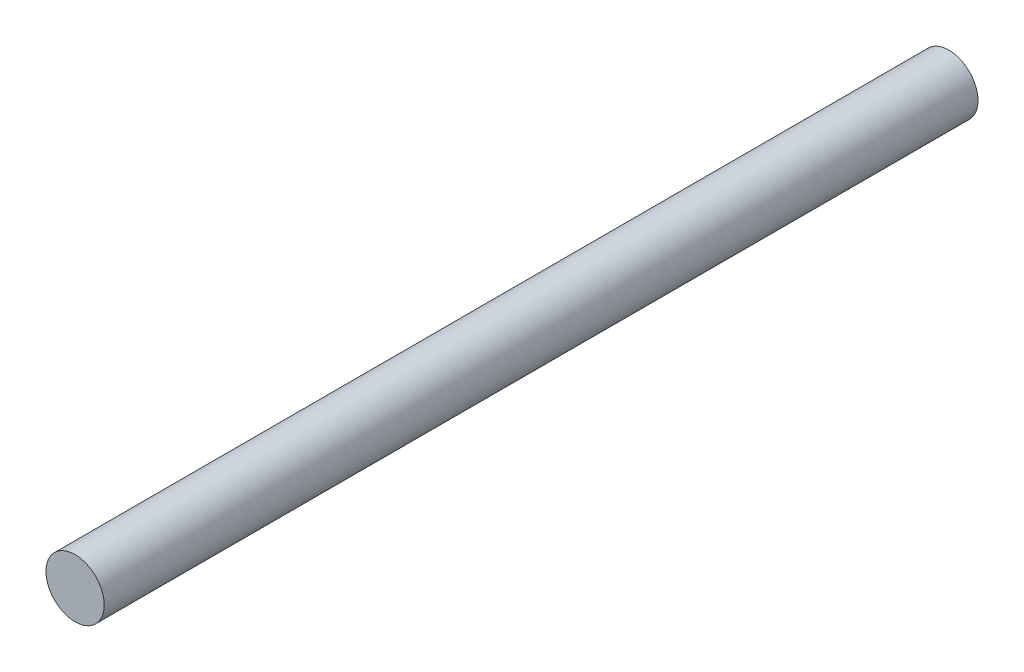
from build123d import *

# Parameters (mm, degrees)
SKETCH_1_R                     = 5
M10_THREADED_SPINDLE_150_DEPTH = 150


with BuildPart() as part:
    # 草图1 → M10_threaded_spindle_150 (new body)
    with BuildSketch(Plane.XY):
        Circle(SKETCH_1_R)
    extrude(amount=M10_THREADED_SPINDLE_150_DEPTH)


solid = part.part
